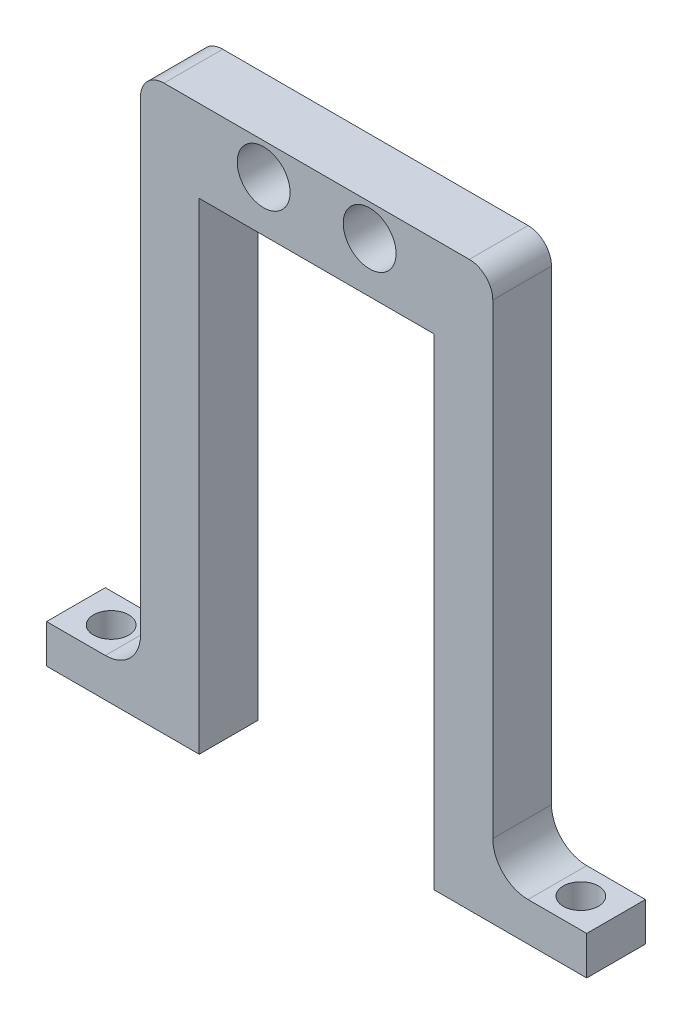
from build123d import *

# Parameters (mm, degrees)
SKETCH1_W               = 5
SKETCH1_H               = 3.288029927
SKETCH1_W_2             = 8
BOSS_EXTRUDE1_DEPTH     = 5
FILLET1_R               = 2
CUT_EXTRUDE1_DEPTH      = 56.795701159
CUT_EXTRUDE1_DEPTH_BACK = 56.795701159
SKETCH2_R               = 1.5
CUT_EXTRUDE2_DEPTH      = 59.463663929
CUT_EXTRUDE2_DEPTH_BACK = 59.463663929
SKETCH3_R               = 2.25
FILLET2_R               = 3


with BuildPart() as part:
    # Sketch1 → Boss-Extrude1 (new body)
    with BuildSketch(Plane.XY):
        Polygon((-5, 3.288029927), (0, 3.288029927), (0, 41), (20, 41), (20, 3.288029927), (25, 3.288029927), (25, 48), (-5, 48), align=None)
        with Locations((-2.5, 1.644014964)):
            Rectangle(SKETCH1_W, SKETCH1_H)
        with Locations((-9, 1.644014964)):
            Rectangle(SKETCH1_W_2, SKETCH1_H)
        with Locations((22.5, 1.644014964)):
            Rectangle(SKETCH1_W, SKETCH1_H)
        with Locations((29, 1.644014964)):
            Rectangle(SKETCH1_W_2, SKETCH1_H)
    extrude(amount=-BOSS_EXTRUDE1_DEPTH)

    # Fillet1
    fillet1_edges = [part.edges().sort_by_distance(p)[0] for p in [
        (-5, 48, -2.5),
        (25, 48, -2.5),
    ]]
    fillet(fillet1_edges, radius=FILLET1_R)

    # Sketch2 → Cut-Extrude1 (cut, two sides: drawn at the far end of the back side and taken through both)
    with BuildSketch(Plane(origin=(0, 3.288029927, 0), x_dir=(1, 0, 0), z_dir=(0, 1, 0)).offset(-CUT_EXTRUDE1_DEPTH_BACK)):
        with Locations(Location((-10, 2.5, 0), (0, 0, 180))):
            Circle(SKETCH2_R)
        with Locations(Location((30, 2.5, 0), (0, 0, 180))):
            Circle(SKETCH2_R)
    extrude(amount=CUT_EXTRUDE1_DEPTH + CUT_EXTRUDE1_DEPTH_BACK, mode=Mode.SUBTRACT)

    # Sketch3 → Cut-Extrude2 (cut, two sides: drawn at the far end of the back side and taken through both)
    with BuildSketch(Plane.XY.offset(-CUT_EXTRUDE2_DEPTH_BACK)):
        with Locations((14.513536336, 45.3)):
            Circle(SKETCH3_R)
        with Locations((5.486463664, 45.3)):
            Circle(SKETCH3_R)
    extrude(amount=CUT_EXTRUDE2_DEPTH + CUT_EXTRUDE2_DEPTH_BACK, mode=Mode.SUBTRACT)

    # Fillet2
    fillet2_edges = [part.edges().sort_by_distance(p)[0] for p in [
        (25, 3.288029927, -2.5),
        (-5, 3.288029927, -2.5),
    ]]
    fillet(fillet2_edges, radius=FILLET2_R)


solid = part.part
